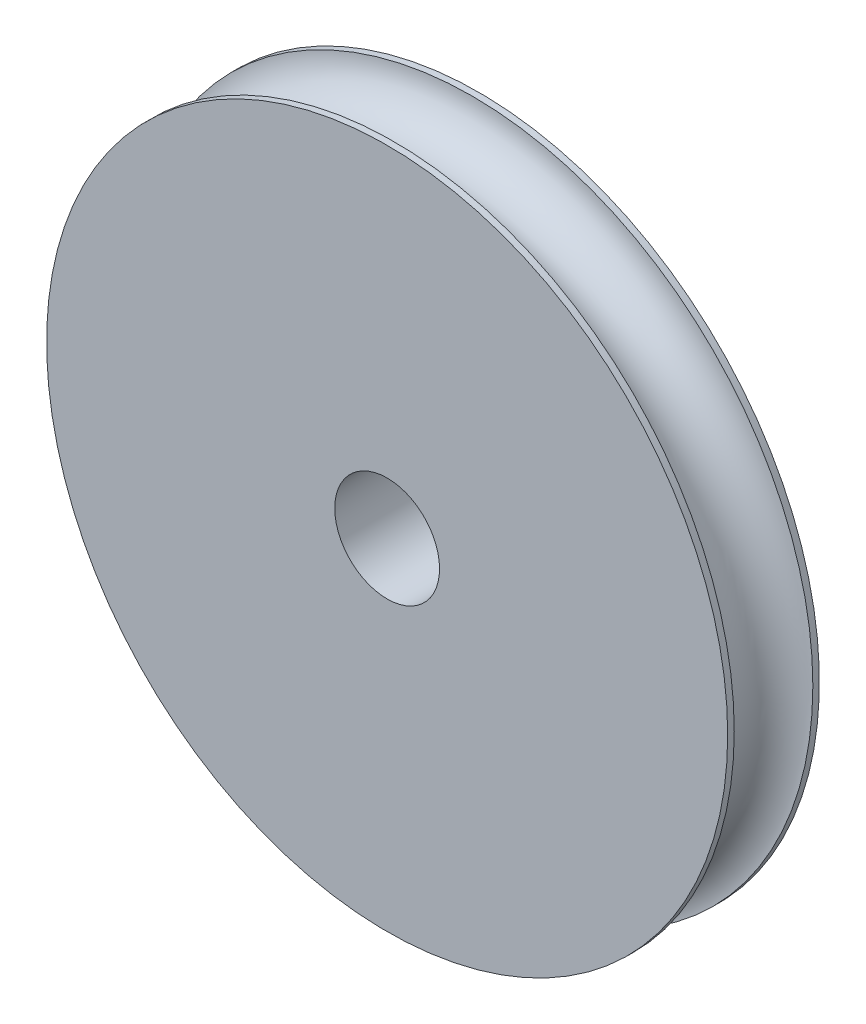
from build123d import *

# Parameters (mm, degrees)
SKETCH1_W           = 23
SKETCH1_H           = 6
SKETCH2_R           = 26
SKETCH2_R_2         = 1
BOSS_EXTRUDE1_DEPTH = 0.5
BOSS_EXTRUDE2_START = 0.5
SKETCH3_R           = 26
BOSS_EXTRUDE2_DEPTH = 0.5
SKETCH4_R           = 1
CUT_EXTRUDE2_DEPTH  = 7
SKETCH5_R           = 4
CUT_EXTRUDE3_DEPTH  = 10


with BuildPart() as part:
    # Sketch1 → Revolve1 (revolve)
    with BuildSketch(Plane(origin=(0, 0, 0), x_dir=(1, 0, 0), z_dir=(0, 1, 0))):
        with BuildLine():
            Line((23, 6), (23, 3))
            ThreePointArc((23, 3), (23.878679656, 5.121320344), (26, 6))
            Line((26, 6), (23, 6))
        make_face()
        with BuildLine():
            Line((23, 3), (23, 0))
            Line((23, 0), (26, 0))
            ThreePointArc((26, 0), (23.878679656, 0.878679656), (23, 3))
        make_face()
        with Locations((11.5, 3)):
            Rectangle(SKETCH1_W, SKETCH1_H)
    revolve(axis=Axis((0, 0, 0), (0, 0, -1)))

    # Sketch2 → Boss-Extrude1 (add)
    with BuildSketch(Plane.XY):
        Circle(SKETCH2_R)
        Circle(SKETCH2_R_2, mode=Mode.SUBTRACT)
    extrude(amount=BOSS_EXTRUDE1_DEPTH)

    # Sketch3 → Boss-Extrude2 (add)
    with BuildSketch(Plane(origin=(0, 0, -6), x_dir=(-1, 0, 0), z_dir=(0, 0, -1)).offset(BOSS_EXTRUDE2_START)):
        with Locations(Location((0, 0, 0), (0, 0, 180))):
            Circle(SKETCH3_R)
    extrude(amount=-BOSS_EXTRUDE2_DEPTH)

    # Sketch4 → Cut-Extrude2 (cut)
    with BuildSketch(Plane(origin=(0, 0, -6.5), x_dir=(-1, 0, 0), z_dir=(0, 0, -1))):
        Circle(SKETCH4_R)
    extrude(amount=-CUT_EXTRUDE2_DEPTH, mode=Mode.SUBTRACT)

    # Sketch5 → Cut-Extrude3 (cut)
    with BuildSketch(Plane(origin=(0, 0, -6.5), x_dir=(-1, 0, 0), z_dir=(0, 0, -1))):
        Circle(SKETCH5_R)
    extrude(amount=-CUT_EXTRUDE3_DEPTH, mode=Mode.SUBTRACT)


solid = part.part
